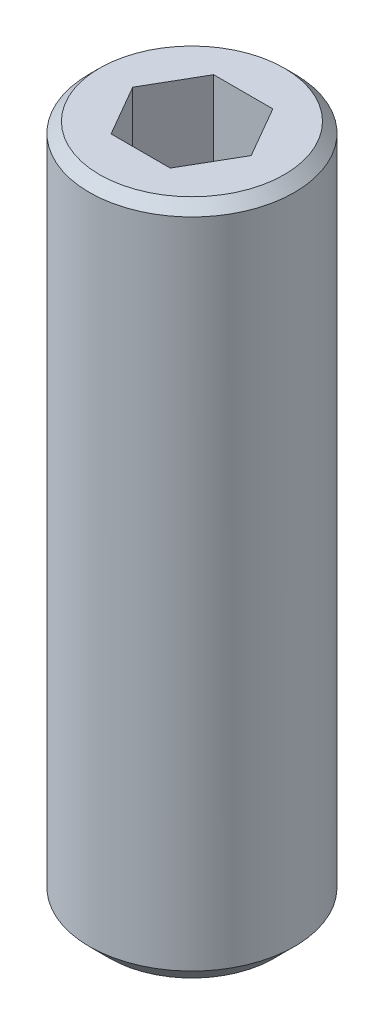
from build123d import *

# Parameters (mm, degrees)
CROQUIS1_W            = 1.5
CROQUIS1_H            = 10
CORTAR_EXTRUIR2_DEPTH = 1.5
CHAFL_N3_SIZE         = 0.3
CHAFL_N4_SIZE         = 0.15


with BuildPart() as part:
    # Croquis1 → Revolución1 (revolve)
    with BuildSketch(Plane.XY, mode=Mode.PRIVATE) as revoluci_n1_sk:
        with Locations((0.75, -5)):
            Rectangle(CROQUIS1_W, CROQUIS1_H)
    revolve(revoluci_n1_sk.sketch.rotate(Axis((0, 0, 0), (0, -1, 0)), 90), axis=Axis((0, 0, 0), (0, -1, 0)))

    # Croquis3 → Cortar-Extruir2 (cut)
    with BuildSketch(Plane(origin=(0, 0, 0), x_dir=(1, 0, 0), z_dir=(0, 1, 0))):
        Polygon((-0.433012702, 0.75), (-0.866025404, 0), (-0.433012702, -0.75), (0.433012702, -0.75), (0.866025404, 0), (0.433012702, 0.75), align=None)
    extrude(amount=-CORTAR_EXTRUIR2_DEPTH, mode=Mode.SUBTRACT)

    # Chaflán3
    chafl_n3_edges = [part.edges().sort_by_distance(p)[0] for p in [
        (0, -10, -1.5),
    ]]
    chamfer(chafl_n3_edges, length=CHAFL_N3_SIZE)

    # Chaflán4
    chafl_n4_edges = [part.edges().sort_by_distance(p)[0] for p in [
        (0, 0, -1.5),
    ]]
    chamfer(chafl_n4_edges, length=CHAFL_N4_SIZE)


solid = part.part
